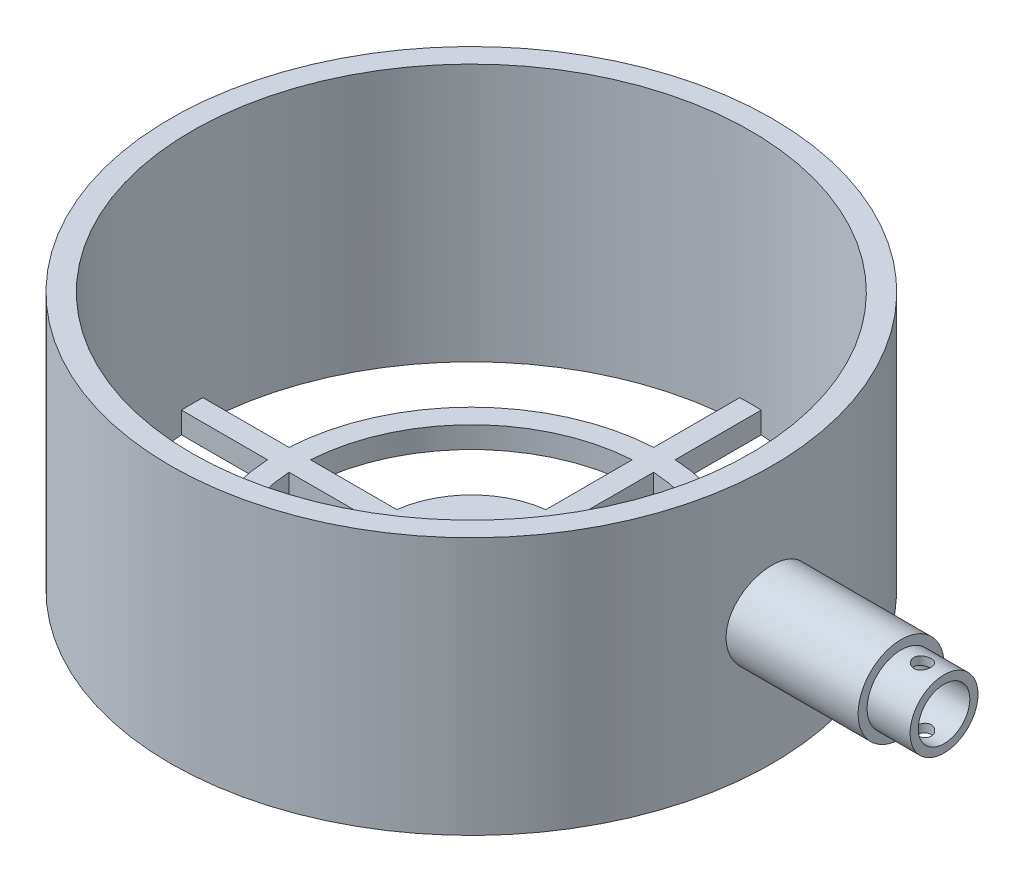
from build123d import *

# Parameters (mm, degrees)
SKETCH1_R                = 70
SKETCH1_R_2              = 65
BOSS_EXTRUDE2_DEPTH      = 60
SKETCH3_R                = 65
BOSS_EXTRUDE4_DEPTH      = 5
CUT_EXTRUDE1_START       = -5
CUT_EXTRUDE1_DEPTH       = 5
SKETCH5_R                = 1.5
CUT_EXTRUDE2_DEPTH       = 5
SKETCH6_R                = 45
SKETCH6_R_2              = 40
BOSS_EXTRUDE5_DEPTH      = 5
BOSS_EXTRUDE7_DEPTH      = 30
BOSS_EXTRUDE7_DEPTH_BACK = 5
SKETCH8_R                = 10
SKETCH10_R               = 7.9
BOSS_EXTRUDE8_DEPTH      = 10
SKETCH11_R               = 6
CUT_EXTRUDE4_DEPTH       = 50
SKETCH13_R               = 2
CUT_EXTRUDE5_DEPTH       = 50


with BuildPart() as part:
    # Sketch1 → Boss-Extrude2 (new body)
    with BuildSketch(Plane(origin=(0, 0, 0), x_dir=(1, 0, 0), z_dir=(0, 1, 0))):
        Circle(SKETCH1_R)
        Circle(SKETCH1_R_2, mode=Mode.SUBTRACT)
    extrude(amount=BOSS_EXTRUDE2_DEPTH)

    # Sketch3 → Boss-Extrude4 (add)
    with BuildSketch(Plane(origin=(0, 0, 0), x_dir=(-1, 0, 0), z_dir=(0, -1, 0))):
        Circle(SKETCH3_R)
    extrude(amount=-BOSS_EXTRUDE4_DEPTH)

    # Sketch4 → Cut-Extrude1 (cut)
    with BuildSketch(Plane(origin=(0, 5, 0), x_dir=(1, 0, 0), z_dir=(0, 1, 0)).offset(CUT_EXTRUDE1_START)):
        with BuildLine():
            ThreePointArc((2.5, 19.843134833), (14.142135624, 14.142135624), (19.843134833, 2.5))
            Line((19.843134833, 2.5), (64.951905284, 2.5))
            ThreePointArc((64.951905284, 2.5), (45.961940777, 45.961940777), (2.5, 64.951905284))
            Line((2.5, 64.951905284), (2.5, 19.843134833))
        make_face()
        with BuildLine():
            Line((64.951905284, -2.5), (19.843134833, -2.5))
            ThreePointArc((19.843134833, -2.5), (14.142135624, -14.142135624), (2.5, -19.843134833))
            Line((2.5, -19.843134833), (2.5, -64.951905284))
            ThreePointArc((2.5, -64.951905284), (45.961940777, -45.961940777), (64.951905284, -2.5))
        make_face()
        with BuildLine():
            ThreePointArc((-19.843134833, 2.5), (-14.141970876, 14.14230037), (-2.499537679, 19.843193074))
            Line((-2.499537679, 19.843193074), (-2.499537679, 64.951923077))
            ThreePointArc((-2.499537679, 64.951923077), (-45.961777201, 45.962104353), (-64.951905284, 2.5))
            Line((-64.951905284, 2.5), (-19.843134833, 2.5))
        make_face()
        with BuildLine():
            Line((-2.499537679, -64.951923077), (-2.499537679, -19.843193074))
            ThreePointArc((-2.499537679, -19.843193074), (-14.141970876, -14.14230037), (-19.843134833, -2.5))
            Line((-19.843134833, -2.5), (-64.951905284, -2.5))
            ThreePointArc((-64.951905284, -2.5), (-45.961777201, -45.962104353), (-2.499537679, -64.951923077))
        make_face()
    extrude(amount=CUT_EXTRUDE1_DEPTH, mode=Mode.SUBTRACT)

    # Sketch5 → Cut-Extrude2 (cut)
    with BuildSketch(Plane(origin=(0, 5, 0), x_dir=(1, 0, 0), z_dir=(0, 1, 0))):
        with Locations((9.5, 0)):
            Circle(SKETCH5_R)
        with Locations((-9.5, 0)):
            Circle(SKETCH5_R)
        with Locations((0, 9.5)):
            Circle(SKETCH5_R)
        with Locations((0, -9.5)):
            Circle(SKETCH5_R)
    extrude(amount=-CUT_EXTRUDE2_DEPTH, mode=Mode.SUBTRACT)

    # Sketch6 → Boss-Extrude5 (add)
    with BuildSketch(Plane(origin=(0, 5, 0), x_dir=(1, 0, 0), z_dir=(0, 1, 0))):
        Circle(SKETCH6_R)
        Circle(SKETCH6_R_2, mode=Mode.SUBTRACT)
    extrude(amount=-BOSS_EXTRUDE5_DEPTH)

    # Sketch8 → Boss-Extrude7 (add, two sides: drawn at the far end of the back side and taken through both)
    with BuildSketch(Plane(origin=(70, 0, 0), x_dir=(0, 0, -1), z_dir=(1, 0, 0)).offset(-BOSS_EXTRUDE7_DEPTH_BACK)):
        with Locations((0, 30)):
            Circle(SKETCH8_R)
    extrude(amount=BOSS_EXTRUDE7_DEPTH + BOSS_EXTRUDE7_DEPTH_BACK)

    # Sketch10 → Boss-Extrude8 (add)
    with BuildSketch(Plane(origin=(100, 0, 0), x_dir=(0, 0, -1), z_dir=(1, 0, 0))):
        with Locations((0, 30)):
            Circle(SKETCH10_R)
    extrude(amount=BOSS_EXTRUDE8_DEPTH)

    # Sketch11 → Cut-Extrude4 (cut)
    with BuildSketch(Plane(origin=(110, 0, 0), x_dir=(0, 0, -1), z_dir=(1, 0, 0))):
        with Locations((0, 30)):
            Circle(SKETCH11_R)
    extrude(amount=-CUT_EXTRUDE4_DEPTH, mode=Mode.SUBTRACT)

    # Sketch13 → Cut-Extrude5 (cut)
    with BuildSketch(Plane(origin=(110, 37.9, 0), x_dir=(1, 0, 0), z_dir=(0, 1, 0))):
        with Locations((-5, 0)):
            Circle(SKETCH13_R)
    extrude(amount=-CUT_EXTRUDE5_DEPTH, mode=Mode.SUBTRACT)


solid = part.part
